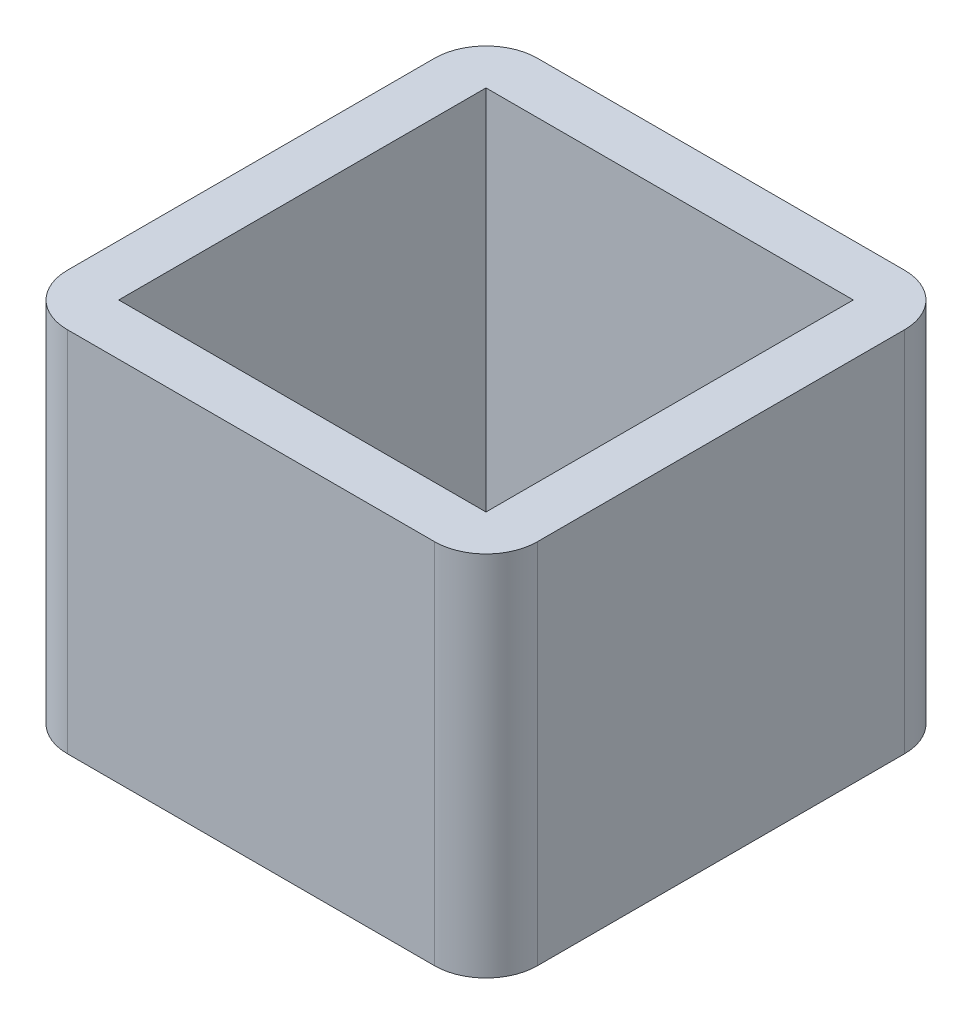
from build123d import *

# Parameters (mm, degrees)
BOSS_EXTRUDE1_DEPTH = 20
SKETCH3_W           = 20
SKETCH3_H           = 20
CUT_EXTRUDE1_DEPTH  = 1040.5


with BuildPart() as part:
    # Sketch1 → Boss-Extrude1 (new body)
    with BuildSketch(Plane(origin=(0, 0, 0), x_dir=(1, 0, 0), z_dir=(0, 1, 0))):
        with BuildLine():
            Line((2.8, 0), (22.8, 0))
            ThreePointArc((22.8, 0), (24.779898987, -0.820101013), (25.6, -2.8))
            Line((25.6, -2.8), (25.6, -22.8))
            ThreePointArc((25.6, -22.8), (24.779898987, -24.779898987), (22.8, -25.6))
            Line((22.8, -25.6), (2.8, -25.6))
            ThreePointArc((2.8, -25.6), (0.820101013, -24.779898987), (0, -22.8))
            Line((0, -22.8), (0, -2.8))
            ThreePointArc((0, -2.8), (0.820101013, -0.820101013), (2.8, 0))
        make_face()
    extrude(amount=BOSS_EXTRUDE1_DEPTH)

    # Sketch3 → Cut-Extrude1 (cut)
    with BuildSketch(Plane(origin=(0, 0, 0), x_dir=(-1, 0, 0), z_dir=(0, -1, 0))):
        with Locations((-12.8, -12.8)):
            Rectangle(SKETCH3_W, SKETCH3_H)
    extrude(amount=-CUT_EXTRUDE1_DEPTH, mode=Mode.SUBTRACT)


solid = part.part
